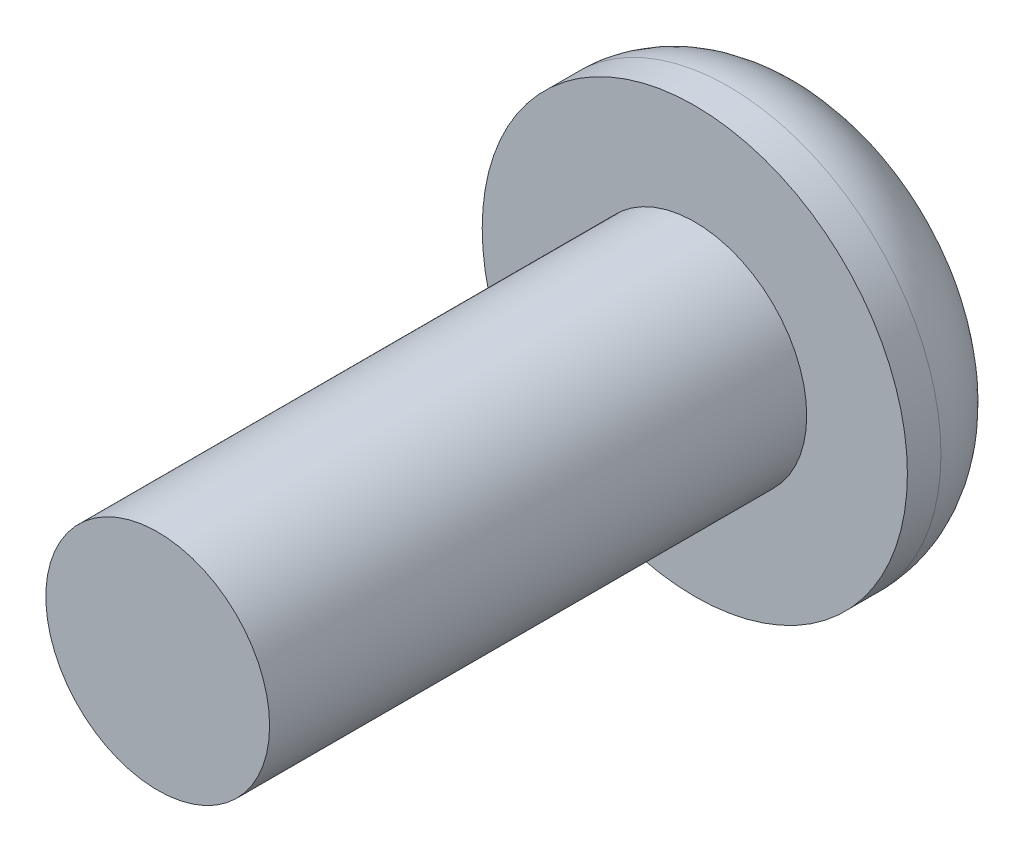
from build123d import *

# Parameters (mm, degrees)
SKETCH_1_R      = 2.5
EXTRUDE_1_DEPTH = 12
SKETCH_2_R      = 4.75
EXTRUDE_2_DEPTH = 2.75
FILLET_1_R      = 2


with BuildPart() as part:
    # 草图1 → 凸台-拉伸1 (new body)
    with BuildSketch(Plane.XY):
        Circle(SKETCH_1_R)
    extrude(amount=EXTRUDE_1_DEPTH)

    # 草图2 → 凸台-拉伸2 (add)
    with BuildSketch(Plane(origin=(0, 0, 0), x_dir=(-1, 0, 0), z_dir=(0, 0, -1))):
        Circle(SKETCH_2_R)
    extrude(amount=EXTRUDE_2_DEPTH)

    # 圆角1
    fillet_1_edges = [part.edges().sort_by_distance(p)[0] for p in [
        (4.75, 0, -2.75),
    ]]
    fillet(fillet_1_edges, radius=FILLET_1_R)


solid = part.part
